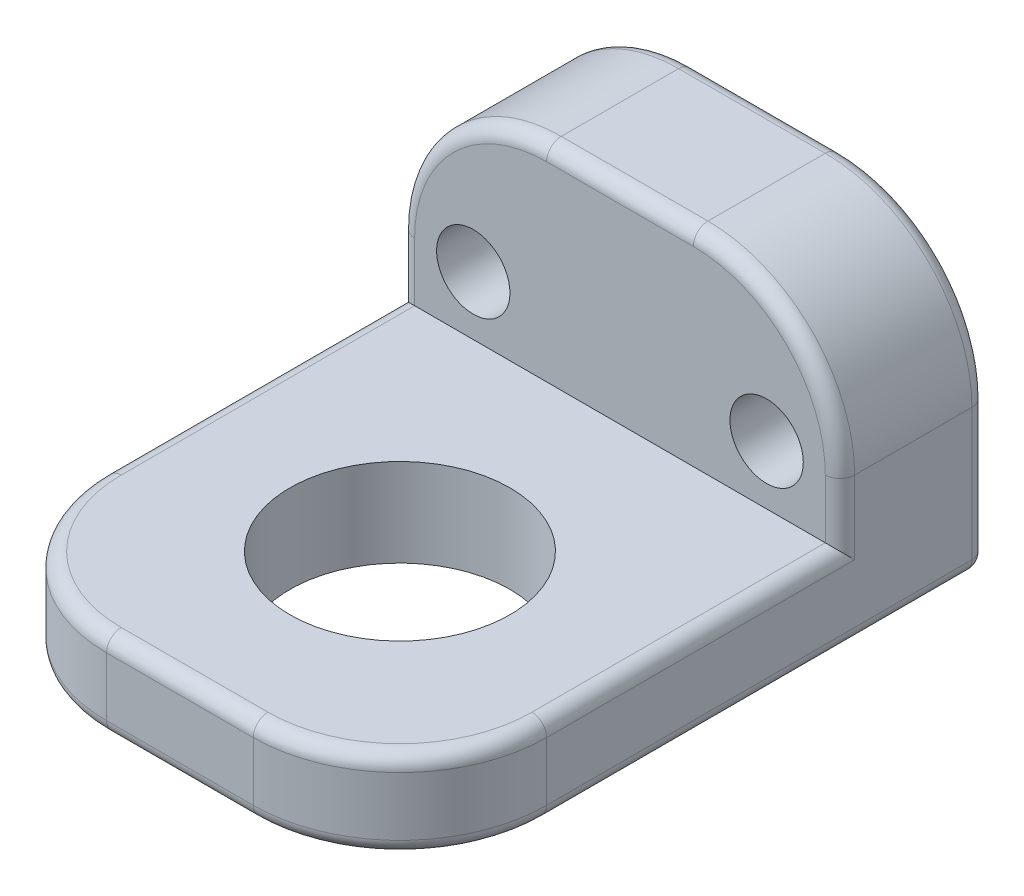
from build123d import *

# Parameters (mm, degrees)
SKETCH_1_W          = 30
SKETCH_1_H          = 20
EXTRUDE_1_DEPTH     = 10
SKETCH_2_R          = 2.5
CUT_EXTRUDE_1_DEPTH = 21.615528128
SKETCH_3_W          = 30
SKETCH_3_H          = 6
EXTRUDE_2_DEPTH     = 30
SKETCH_4_R          = 7.5
CUT_EXTRUDE_2_DEPTH = 30
FILLET_1_R          = 10
FILLET_2_R          = 10
FILLET_3_R          = 1
FILLET_4_R          = 1


with BuildPart() as part:
    # 草图1 → 凸台-拉伸1 (new body)
    with BuildSketch(Plane.XY):
        Rectangle(SKETCH_1_W, SKETCH_1_H)
    extrude(amount=EXTRUDE_1_DEPTH)

    # 草图2 → 切除-拉伸1 (cut, through all)
    with BuildSketch(Plane.XY.offset(10)):
        with Locations((-10, 0)):
            Circle(SKETCH_2_R)
        with Locations((10, 0)):
            Circle(SKETCH_2_R)
    extrude(amount=-CUT_EXTRUDE_1_DEPTH, mode=Mode.SUBTRACT)

    # 草图3 → 凸台-拉伸2 (add)
    with BuildSketch(Plane.XY.offset(10)):
        with Locations((0, -7)):
            Rectangle(SKETCH_3_W, SKETCH_3_H)
    extrude(amount=EXTRUDE_2_DEPTH)

    # 草图4 → 切除-拉伸2 (cut)
    with BuildSketch(Plane.XZ.offset(10)):
        with Locations(Location((0, 25, 0), (0, 0, 270))):
            Circle(SKETCH_4_R)
    extrude(amount=-CUT_EXTRUDE_2_DEPTH, mode=Mode.SUBTRACT)

    # 圆角1
    fillet_1_edges = [part.edges().sort_by_distance(p)[0] for p in [
        (-15, -7, 40),
        (15, -7, 40),
    ]]
    fillet(fillet_1_edges, radius=FILLET_1_R)

    # 圆角2
    fillet_2_edges = [part.edges().sort_by_distance(p)[0] for p in [
        (-15, 10, 5),
        (15, 10, 5),
    ]]
    fillet(fillet_2_edges, radius=FILLET_2_R)

    # 圆角3
    fillet_3_edges = [part.edges().sort_by_distance(p)[0] for p in [
        (0, -10, 40),
        (0, -10, 0),
        (15, -10, 15),
        (-15, -10, 15),
        (12.071067812, -10, 37.071067812),
        (-12.071067812, -10, 37.071067812),
        (15, -5, 0),
        (0, 10, 0),
        (-15, -5, 0),
        (-12.071067812, 7.071067812, 0),
        (12.071067812, 7.071067812, 0),
    ]]
    fillet(fillet_3_edges, radius=FILLET_3_R)

    # 圆角4
    fillet_4_edges = [part.edges().sort_by_distance(p)[0] for p in [
        (15, -2, 10),
        (0, -4, 40),
        (-15, -4, 20),
        (15, -4, 20),
        (12.071067812, -4, 37.071067812),
        (-12.071067812, -4, 37.071067812),
        (0, 10, 10),
        (-15, -2, 10),
        (-12.071067812, 7.071067812, 10),
        (12.071067812, 7.071067812, 10),
    ]]
    fillet(fillet_4_edges, radius=FILLET_4_R)


solid = part.part
